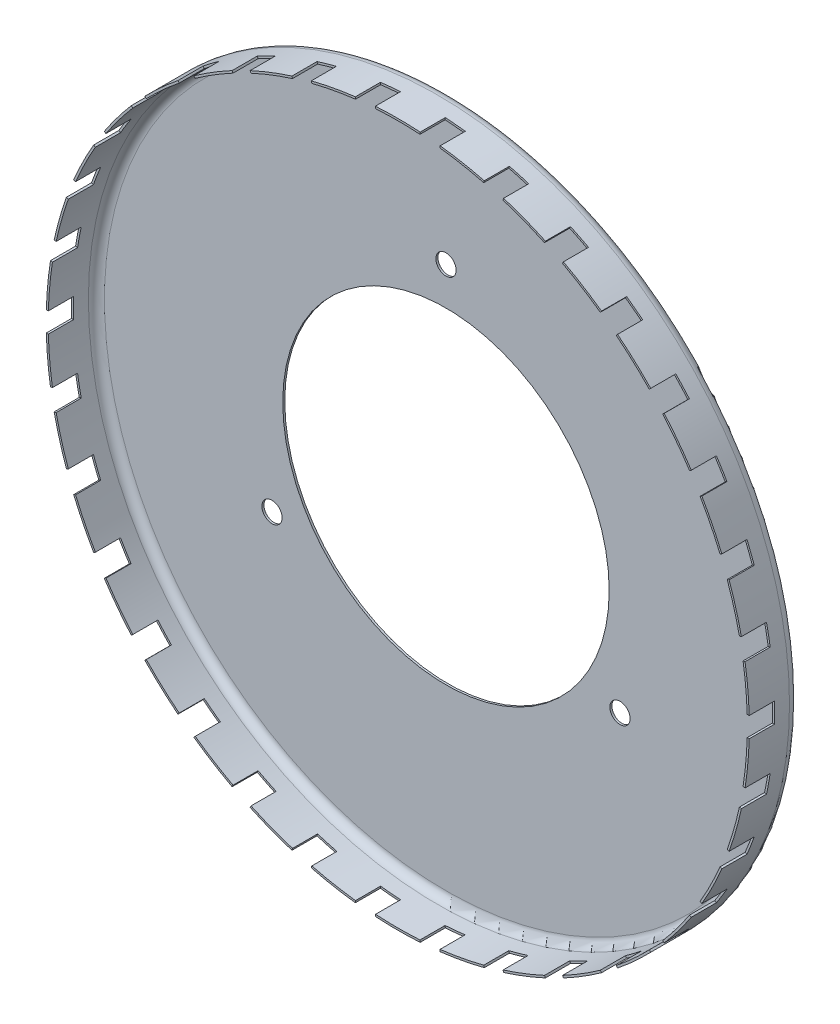
from build123d import *

# Parameters (mm, degrees)
SKETCH1_R                  = 88.9
EXTRUDE1_DEPTH             = 12.7
FILLET1_R                  = 2.54
SHELL1_T                   = -0.508
F_1_1_DIAMETER_HOLE1_D     = 82.55
F_1_1_DIAMETER_HOLE1_DEPTH = 17.78
F_1_1_DIAMETER_HOLE1_TIP   = 24.80052205
SKETCH3_W                  = 6.35
SKETCH3_H                  = 5.08
EXTRUDE2_DEPTH             = 127.363404513
CIRPATTERN1_COUNT          = 17
F_10_CLEARANCE_HOLE1_D     = 5.1054
CIRPATTERN2_COUNT          = 3


with BuildPart() as part:
    # Sketch1 → Extrude1 (new body)
    with BuildSketch(Plane.XY):
        Circle(SKETCH1_R)
    extrude(amount=EXTRUDE1_DEPTH)

    # Fillet1
    fillet1_edges = [part.edges().sort_by_distance(p)[0] for p in [
        (-88.9, 0, 0),
    ]]
    fillet(fillet1_edges, radius=FILLET1_R)

    # Shell1
    shell1_openings = [part.faces().sort_by_distance(p)[0] for p in [
        (0, 0, 12.7),
    ]]
    offset(amount=SHELL1_T, openings=shell1_openings, kind=Kind.INTERSECTION)

    # 1 (1) Diameter Hole1
    with Locations(Plane.XY.offset(0.508)):
        with Locations((0, 0)):
            Hole(F_1_1_DIAMETER_HOLE1_D / 2, depth=F_1_1_DIAMETER_HOLE1_DEPTH)
            with Locations((0, 0, -(F_1_1_DIAMETER_HOLE1_DEPTH + F_1_1_DIAMETER_HOLE1_TIP / 2))):  # 118° drill point
                Cone(0, F_1_1_DIAMETER_HOLE1_D / 2, F_1_1_DIAMETER_HOLE1_TIP, mode=Mode.SUBTRACT)

    # Sketch3 → Extrude2 (cut, symmetric)
    with BuildSketch(Plane(origin=(0, 0, 0), x_dir=(0, 0, -1), z_dir=(1, 0, 0))):
        with Locations((-9.525, 0)):
            Rectangle(SKETCH3_W, SKETCH3_H)
    extrude2 = extrude(amount=EXTRUDE2_DEPTH, both=True, mode=Mode.SUBTRACT)

    # CirPattern1: Extrude2 ×17 about axis
    cirpattern1_axis = Axis((0, 0, 0), (0, 0, 1))
    for i in range(1, CIRPATTERN1_COUNT):
        add(extrude2.rotate(cirpattern1_axis, i * 360 / CIRPATTERN1_COUNT), mode=Mode.SUBTRACT)

    # #10 Clearance Hole1 (through all)
    with Locations(Plane(origin=(0, 50.8, 0.508), x_dir=(1, 0, 0), z_dir=(0, 0, 1))):
        with Locations((0, 0)):
            f_10_clearance_hole1 = Hole(F_10_CLEARANCE_HOLE1_D / 2)

    # CirPattern2: #10 Clearance Hole1 ×3 about axis
    cirpattern2_axis = Axis((0, 0, 0), (0, 0, 1))
    for i in range(1, CIRPATTERN2_COUNT):
        add(f_10_clearance_hole1.rotate(cirpattern2_axis, i * 360 / CIRPATTERN2_COUNT), mode=Mode.SUBTRACT)


solid = part.part
